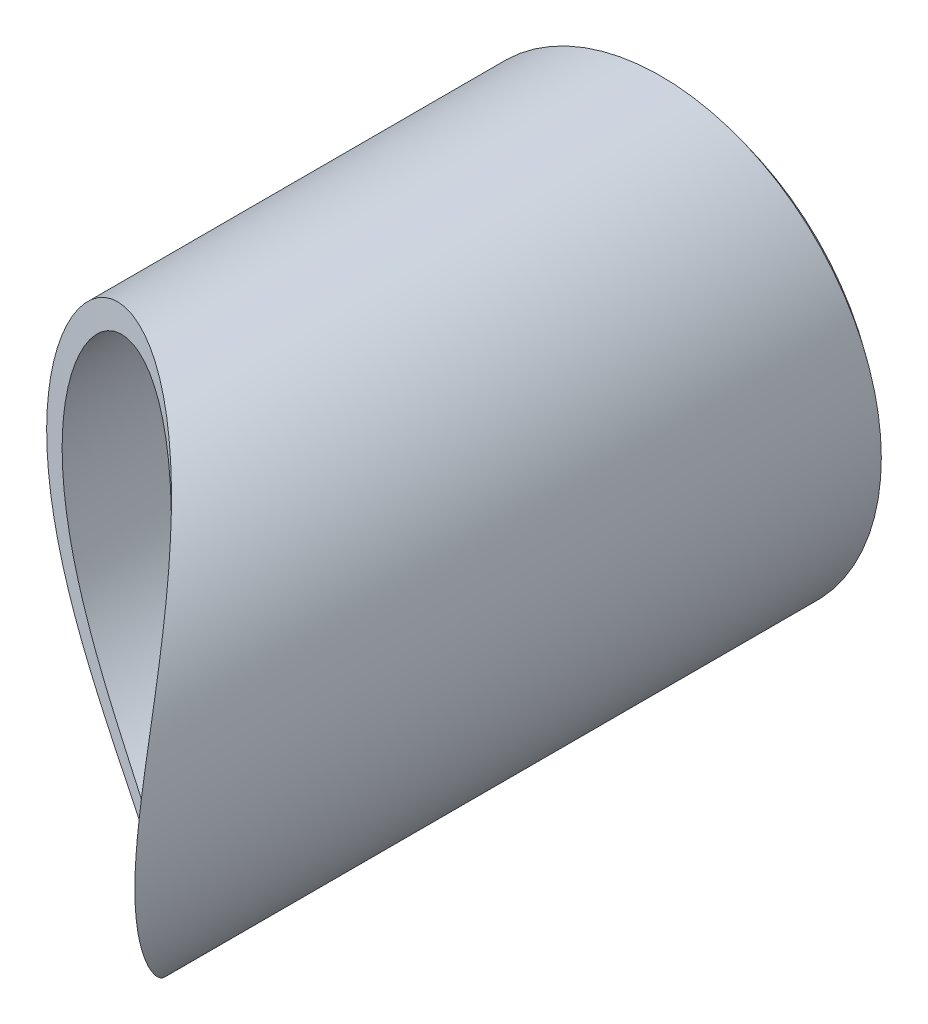
from build123d import *

# Parameters (mm, degrees)
SKETCH1_R               = 57.15
SKETCH1_R_2             = 51.1302
EXTRUDE1_DEPTH          = 98.425
CUT_EXTRUDE1_DEPTH      = 128.356686613
CUT_EXTRUDE1_DEPTH_BACK = 128.356686613
CHAMFER4_SIZE           = 4.445
CHAMFER4_SIZE2          = 3.410768462


with BuildPart() as part:
    # Sketch1 → Extrude1 (new, symmetric)
    with BuildSketch(Plane.XY):
        Circle(SKETCH1_R)
        Circle(SKETCH1_R_2, mode=Mode.SUBTRACT)
    extrude(amount=EXTRUDE1_DEPTH, both=True)

    # Sketch4 → Cut-Extrude1 (cut, two sides: drawn at the far end of the back side and taken through both)
    with BuildSketch(Plane(origin=(0, 0, 0), x_dir=(1, 0, 0), z_dir=(0, 1, 0)).offset(-CUT_EXTRUDE1_DEPTH_BACK)):
        with BuildLine():
            Line((-57.15, -6.985), (-57.15, -98.425))
            Line((-57.15, -98.425), (57.15, -98.425))
            ThreePointArc((57.15, -98.425), (8.513587702, -42.063015372), (-57.15, -6.985))
        make_face()
    extrude(amount=CUT_EXTRUDE1_DEPTH + CUT_EXTRUDE1_DEPTH_BACK, mode=Mode.SUBTRACT)

    # Chamfer4
    chamfer4_edges = [part.edges().sort_by_distance(p)[0] for p in [
        (-57.15, 0, -98.425),
    ]]
    chamfer4_side = [part.faces().sort_by_distance(p)[0] for p in [
        (-55.533553898, 0, -98.425),
    ]]
    chamfer(chamfer4_edges, length=CHAMFER4_SIZE, length2=CHAMFER4_SIZE2, reference=chamfer4_side[0])


solid = part.part
